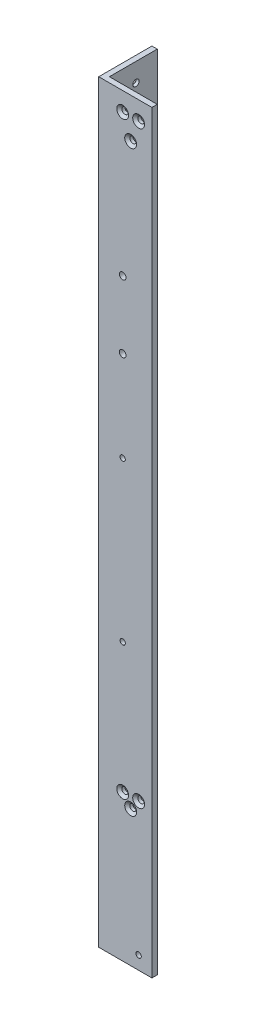
from build123d import *

# Parameters (mm, degrees)
BOSS_EXTRUDE1_DEPTH                               = 450
FRONTSIDEHOLES_SKETCH3_R                          = 1.5875
FRONTSIDEHOLES_SKETCH3_R_2                        = 2
FRONTSIDEHOLES_CUT_EXTRUDE1_DEPTH                 = 3.175
LEFTSIDEHOLES_SKETCH4_R                           = 1.5875
LEFTSIDEHOLES_CUT_EXTRUDE2_DEPTH                  = 3.175
CSK_FOR_6_FLAT_HEAD_MACHINE_SCREW_100_D           = 3.7973
CSK_FOR_6_FLAT_HEAD_MACHINE_SCREW_100_CSINK_D     = 7.0866
CSK_FOR_6_FLAT_HEAD_MACHINE_SCREW_100_CSINK_ANGLE = 100
CSK_FOR_6_FLAT_HEAD_MACHINE_SCREW_2_D             = 3.7973
CSK_FOR_6_FLAT_HEAD_MACHINE_SCREW_2_CSINK_D       = 7.0866
CSK_FOR_6_FLAT_HEAD_MACHINE_SCREW_2_CSINK_ANGLE   = 100


with BuildPart() as part:
    # Sketch2 → Boss-Extrude1 (new body)
    with BuildSketch(Plane(origin=(0, 0, 0), x_dir=(1, 0, 0), z_dir=(0, 1, 0))):
        Polygon((0, 31.75), (3.175, 31.75), (3.175, 3.175), (31.75, 3.175), (31.75, 0), (0, 0), align=None)
    extrude(amount=BOSS_EXTRUDE1_DEPTH)

    # FrontSideHoles-Sketch3 → FrontSideHoles-Cut-Extrude1 (cut)
    with BuildSketch(Plane.XY):
        with Locations((19.05, 81.1125)):
            Circle(FRONTSIDEHOLES_SKETCH3_R)
        with Locations((14.2875, 87.4625)):
            Circle(FRONTSIDEHOLES_SKETCH3_R)
        with Locations((23.8125, 87.4625)):
            Circle(FRONTSIDEHOLES_SKETCH3_R)
        with Locations((14.2875, 438.8875)):
            Circle(FRONTSIDEHOLES_SKETCH3_R)
        with Locations((23.8125, 438.8875)):
            Circle(FRONTSIDEHOLES_SKETCH3_R)
        with Locations((19.05, 426.1875)):
            Circle(FRONTSIDEHOLES_SKETCH3_R)
        with Locations((14.2875, 354.18487)):
            Circle(FRONTSIDEHOLES_SKETCH3_R_2)
        with Locations((14.2875, 313.98487)):
            Circle(FRONTSIDEHOLES_SKETCH3_R_2)
        with Locations((14.2875, 260)):
            Circle(FRONTSIDEHOLES_SKETCH3_R)
        with Locations((14.2875, 165)):
            Circle(FRONTSIDEHOLES_SKETCH3_R)
        with Locations((23.8125, 7.9375)):
            Circle(FRONTSIDEHOLES_SKETCH3_R)
    extrude(amount=-FRONTSIDEHOLES_CUT_EXTRUDE1_DEPTH, mode=Mode.SUBTRACT)

    # LeftSideHoles-Sketch4 → LeftSideHoles-Cut-Extrude2 (cut)
    with BuildSketch(Plane.ZY):
        with Locations((-23.8125, 81.1125)):
            Circle(LEFTSIDEHOLES_SKETCH4_R)
        with Locations((-14.2875, 81.1125)):
            Circle(LEFTSIDEHOLES_SKETCH4_R)
        with Locations((-19.05, 87.4625)):
            Circle(LEFTSIDEHOLES_SKETCH4_R)
        with Locations((-19.05, 438.8875)):
            Circle(LEFTSIDEHOLES_SKETCH4_R)
        with Locations((-23.8125, 426.1875)):
            Circle(LEFTSIDEHOLES_SKETCH4_R)
        with Locations((-14.2875, 426.1875)):
            Circle(LEFTSIDEHOLES_SKETCH4_R)
        with Locations((-23.8125, 341.24737)):
            Circle(LEFTSIDEHOLES_SKETCH4_R)
        with Locations((-14.2875, 341.24737)):
            Circle(LEFTSIDEHOLES_SKETCH4_R)
        with Locations((-23.8125, 306.32237)):
            Circle(LEFTSIDEHOLES_SKETCH4_R)
        with Locations((-14.2875, 306.32237)):
            Circle(LEFTSIDEHOLES_SKETCH4_R)
        with Locations((-23.8125, 7.9375)):
            Circle(LEFTSIDEHOLES_SKETCH4_R)
        with Locations((-14.2875, 165)):
            Circle(LEFTSIDEHOLES_SKETCH4_R)
        with Locations((-14.2875, 260)):
            Circle(LEFTSIDEHOLES_SKETCH4_R)
        with Locations((-14.2875, 355)):
            Circle(LEFTSIDEHOLES_SKETCH4_R)
    extrude(amount=-LEFTSIDEHOLES_CUT_EXTRUDE2_DEPTH, mode=Mode.SUBTRACT)

    # CSK for _6 Flat Head Machine Screw _100 (through all)
    with Locations(Plane.XY):
        with Locations((14.2875, 87.4625), (19.05, 81.1125), (23.8125, 87.4625), (19.05, 426.1875), (14.2875, 438.8875), (23.8125, 438.8875)):
            CounterSinkHole(CSK_FOR_6_FLAT_HEAD_MACHINE_SCREW_100_D / 2, CSK_FOR_6_FLAT_HEAD_MACHINE_SCREW_100_CSINK_D / 2, counter_sink_angle=CSK_FOR_6_FLAT_HEAD_MACHINE_SCREW_100_CSINK_ANGLE)

    # CSK for _6 Flat Head Machine Screw _ 2 (through all)
    with Locations(Plane.ZY):
        with Locations((-19.05, 87.4625), (-23.8125, 81.1125), (-14.2875, 81.1125), (-23.8125, 341.24737), (-14.2875, 341.24737), (-14.2875, 306.32237), (-23.8125, 306.32237), (-23.8125, 426.1875), (-14.2875, 426.1875), (-19.05, 438.8875)):
            CounterSinkHole(CSK_FOR_6_FLAT_HEAD_MACHINE_SCREW_2_D / 2, CSK_FOR_6_FLAT_HEAD_MACHINE_SCREW_2_CSINK_D / 2, counter_sink_angle=CSK_FOR_6_FLAT_HEAD_MACHINE_SCREW_2_CSINK_ANGLE)


solid = part.part
